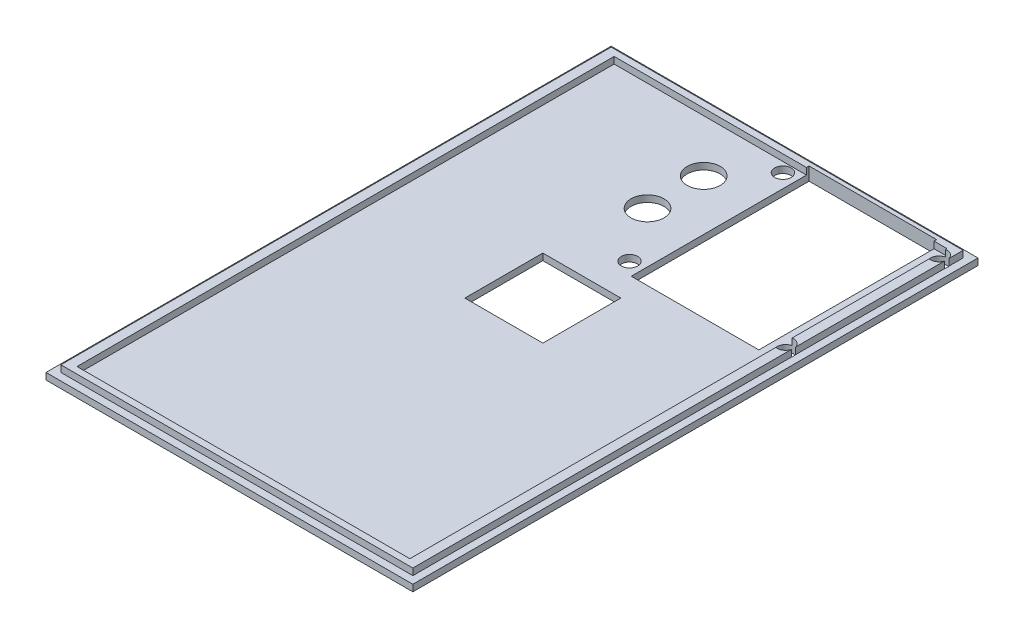
from build123d import *

# Parameters (mm, degrees)
SKETCH1_W           = 55.5
SKETCH1_H           = 85.5
BOSS_EXTRUDE1_DEPTH = 1
SKETCH2_W           = 53.25
SKETCH2_H           = 83.25
SKETCH2_W_2         = 50.3558552
SKETCH2_H_2         = 81.260119932
BOSS_EXTRUDE2_DEPTH = 1
SKETCH3_R           = 2.5
SKETCH3_R_2         = 1.25
SKETCH3_R_3         = 1.248818361
SKETCH3_R_4         = 1.252029075
SKETCH3_W           = 19.3
SKETCH3_H           = 26.9
SKETCH3_W_2         = 11.8
SKETCH3_H_2         = 11.8
CUT_EXTRUDE2_DEPTH  = 3


with BuildPart() as part:
    # Sketch1 → Boss-Extrude1 (new body)
    with BuildSketch(Plane(origin=(0, 0, 0), x_dir=(1, 0, 0), z_dir=(0, 1, 0))):
        Rectangle(SKETCH1_W, SKETCH1_H)
    extrude(amount=BOSS_EXTRUDE1_DEPTH)

    # Sketch2 → Boss-Extrude2 (add)
    with BuildSketch(Plane(origin=(0, 1, 0), x_dir=(1, 0, 0), z_dir=(0, 1, 0))):
        Rectangle(SKETCH2_W, SKETCH2_H)
        Rectangle(SKETCH2_W_2, SKETCH2_H_2, mode=Mode.SUBTRACT)
    extrude(amount=BOSS_EXTRUDE2_DEPTH)

    # Sketch3 → Cut-Extrude2 (cut)
    with BuildSketch(Plane.XZ):
        with Locations(Location((-3.75, -32.75, 0), (0, 0, 270))):
            Circle(SKETCH3_R)
        with Locations(Location((-3.75, -24.25, 0), (0, 0, 270))):
            Circle(SKETCH3_R)
        with Locations(Location((1.819004369, -15.96241079, 0), (0, 0, 270))):
            Circle(SKETCH3_R_2)
        with Locations(Location((25.419004357, -15.963142334, 0), (0, 0, 270))):
            Circle(SKETCH3_R_3)
        with Locations(Location((1.818587591, -39.162410787, 0), (0, 0, 270))):
            Circle(SKETCH3_R_2)
        with Locations(Location((25.419004357, -39.162410787, 0), (0, 0, 270))):
            Circle(SKETCH3_R_4)
        with Locations((13.569004369, -27.574665711)):
            Rectangle(SKETCH3_W, SKETCH3_H)
        with Locations((0.091347466, -4.575788212)):
            Rectangle(SKETCH3_W_2, SKETCH3_H_2)
    extrude(amount=-CUT_EXTRUDE2_DEPTH, mode=Mode.SUBTRACT)


solid = part.part
